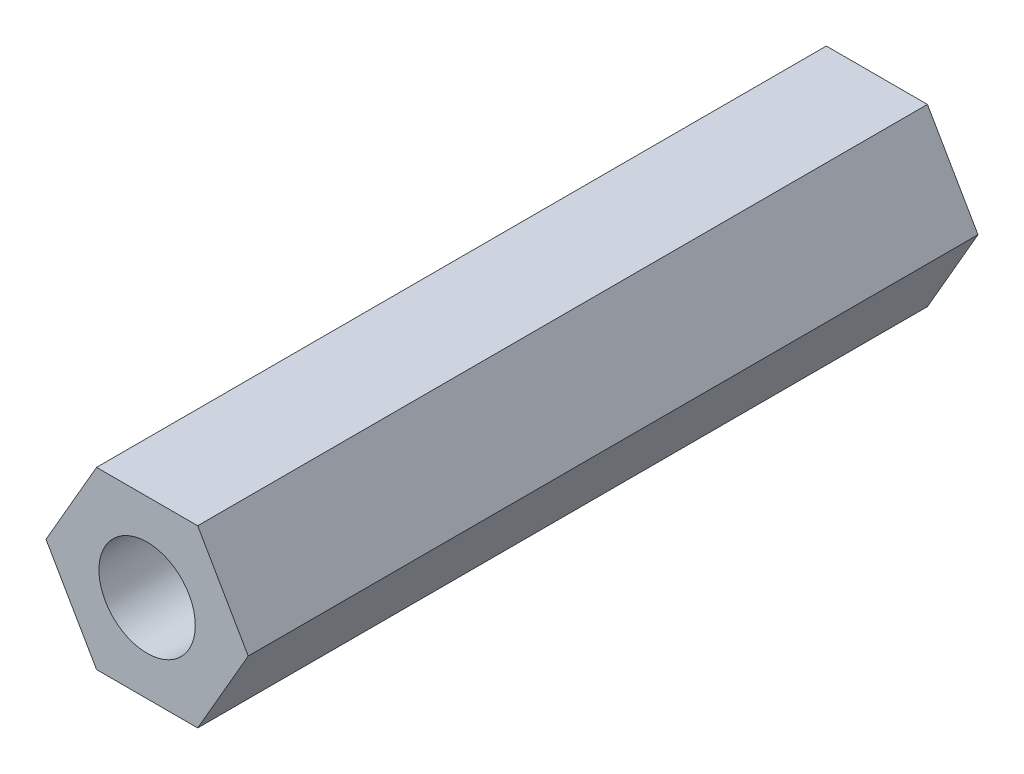
from build123d import *

# Parameters (mm, degrees)
SKETCH1_R           = 1.65
BOSS_EXTRUDE1_DEPTH = 25


with BuildPart() as part:
    # Sketch1 → Boss-Extrude1 (new body)
    with BuildSketch(Plane.XY):
        Polygon((1.732050808, 3), (-1.732050808, 3), (-3.464101615, 0), (-1.732050808, -3), (1.732050808, -3), (3.464101615, 0), align=None)
        Circle(SKETCH1_R, mode=Mode.SUBTRACT)
    extrude(amount=BOSS_EXTRUDE1_DEPTH)


solid = part.part
